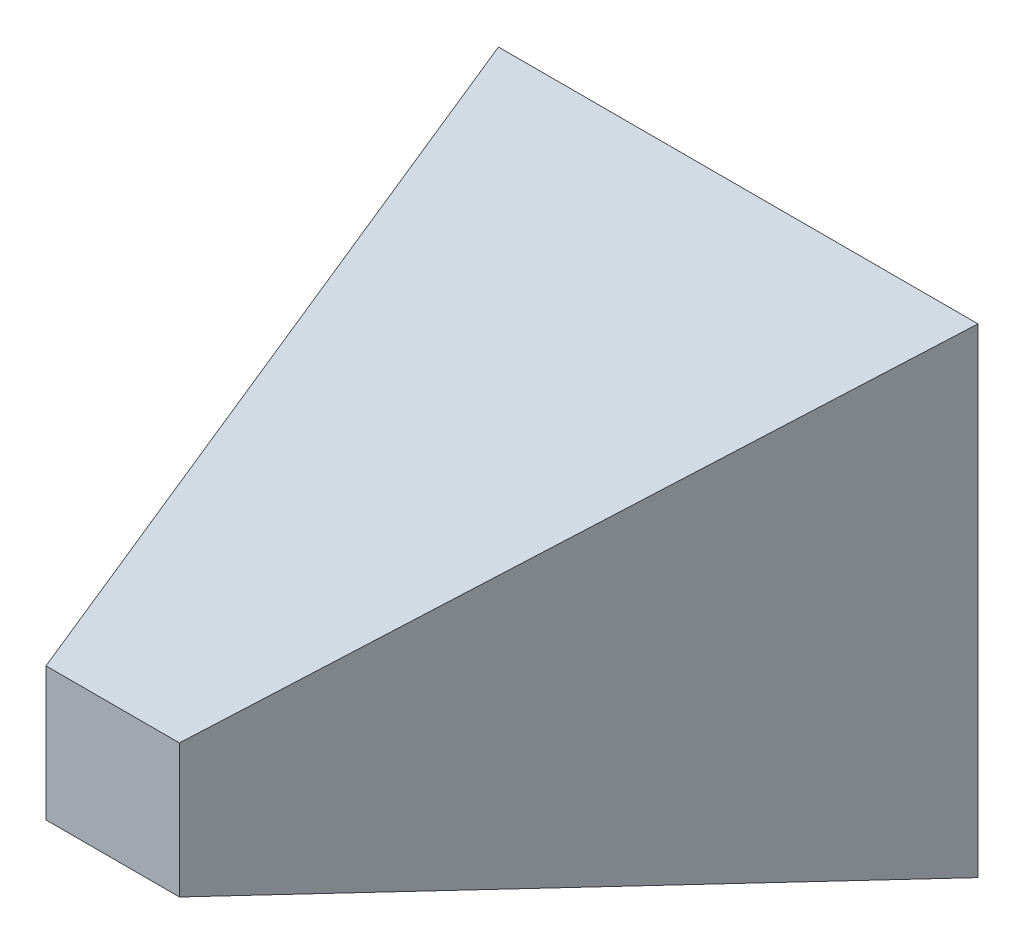
from build123d import *


with BuildPart() as part:
    # Sketch2 → Loft1 section 0
    with BuildSketch(Plane.XY.offset(150)):
        with BuildLine():
            Line((41.5, 50.221573985), (73.5, 50.221573985))
            Line((73.5, 50.221573985), (73.5, 82.221573985))
            Line((73.5, 82.221573985), (41.5, 82.221573985))
            Line((41.5, 82.221573985), (41.5, 50.221573985))
        make_face()
    # Sketch1 → Loft1 section 1
    with BuildSketch(Plane.XY):
        with BuildLine():
            Line((0, 0), (115, 0))
            Line((115, 0), (115, 115))
            Line((115, 115), (0, 115))
            Line((0, 115), (0, 0))
        make_face()
    loft()


solid = part.part
